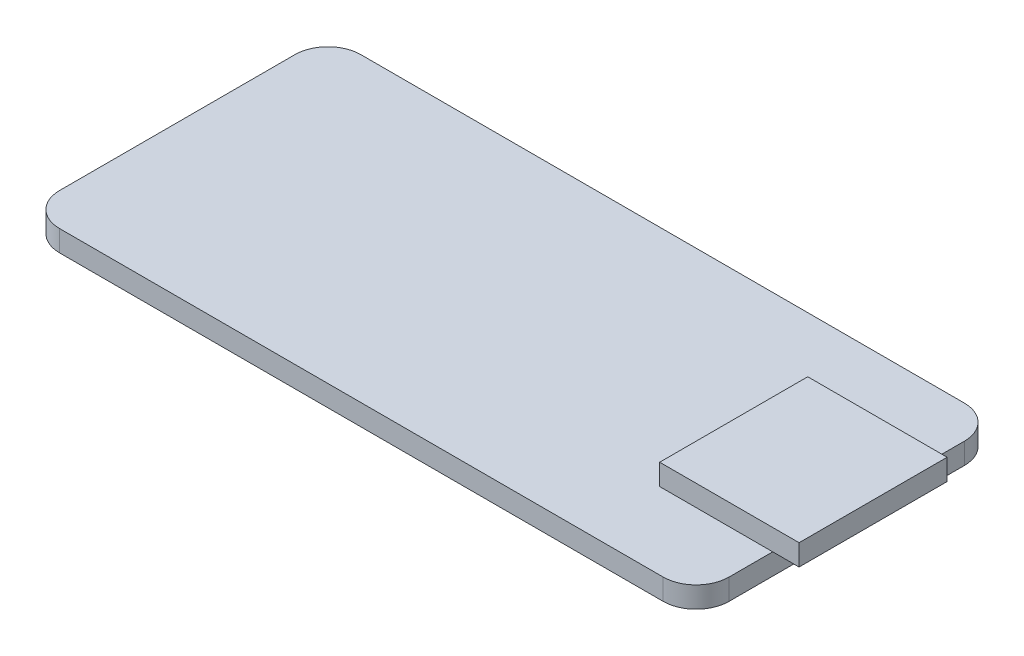
from build123d import *

# Parameters (mm, degrees)
BOSS_EXTRUDE1_DEPTH = 1.6
SKETCH2_W           = 10.577290559
SKETCH2_H           = 11.232520948
BOSS_EXTRUDE2_DEPTH = 1.6


with BuildPart() as part:
    # Sketch1 → Boss-Extrude1 (new body)
    with BuildSketch(Plane(origin=(0, 0, 0), x_dir=(1, 0, 0), z_dir=(0, 1, 0))):
        with BuildLine():
            Line((-22.9, 11.43), (22.9, 11.43))
            ThreePointArc((22.9, 11.43), (24.667766953, 10.697766953), (25.4, 8.93))
            Line((25.4, 8.93), (25.4, -8.93))
            ThreePointArc((25.4, -8.93), (24.667766953, -10.697766953), (22.9, -11.43))
            Line((22.9, -11.43), (-22.9, -11.43))
            ThreePointArc((-22.9, -11.43), (-24.667766953, -10.697766953), (-25.4, -8.93))
            Line((-25.4, -8.93), (-25.4, 8.93))
            ThreePointArc((-25.4, 8.93), (-24.667766953, 10.697766953), (-22.9, 11.43))
        make_face()
    extrude(amount=BOSS_EXTRUDE1_DEPTH)

    # Sketch2 → Boss-Extrude2 (add)
    with BuildSketch(Plane(origin=(0, 1.6, 0), x_dir=(1, 0, 0), z_dir=(0, 1, 0))):
        with Locations((22.111354721, 0)):
            Rectangle(SKETCH2_W, SKETCH2_H)
    extrude(amount=BOSS_EXTRUDE2_DEPTH)


solid = part.part
